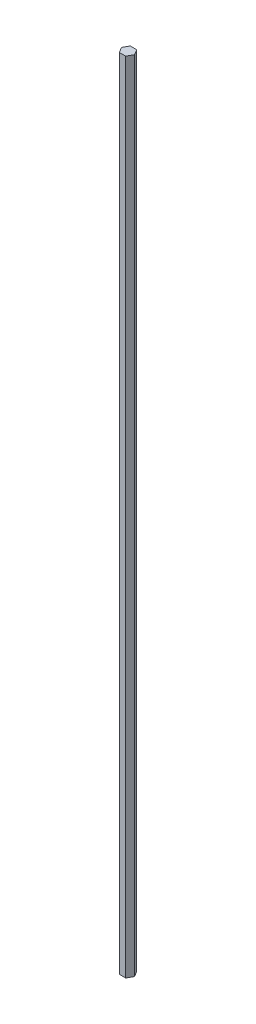
from build123d import *

# Parameters (mm, degrees)
BOSS_EXTRUDE1_DEPTH = 914.4


with BuildPart() as part:
    # Sketch1 → Boss-Extrude1 (new body)
    with BuildSketch(Plane(origin=(0, 0, 0), x_dir=(1, 0, 0), z_dir=(0, 1, 0))):
        Polygon((7.332348419, 0), (3.666174209, 6.35), (-3.666174209, 6.35), (-7.332348419, 0), (-3.666174209, -6.35), (3.666174209, -6.35), align=None)
    extrude(amount=BOSS_EXTRUDE1_DEPTH)


solid = part.part
